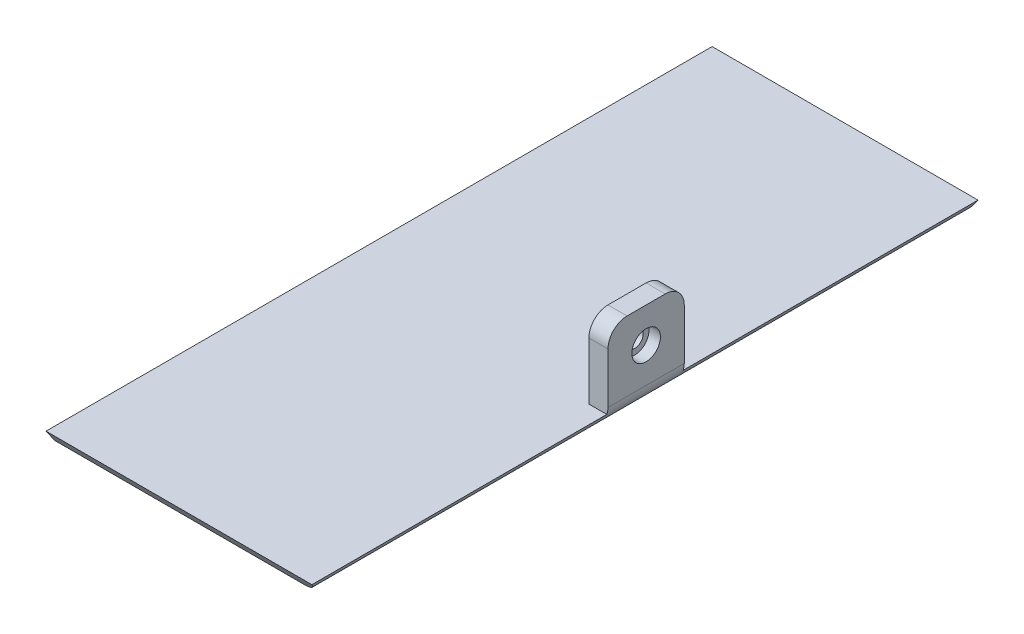
from build123d import *

# Parameters (mm, degrees)
BOSS_EXTRUDE1_DEPTH     = 70
SKETCH3_W               = 5
SKETCH3_H               = 20
BOSS_EXTRUDE2_DEPTH     = 20
CUT_EXTRUDE2_DEPTH      = 114.967153248
CUT_EXTRUDE2_DEPTH_BACK = 114.967153248
CUT_EXTRUDE3_REACH      = 115.967
SKETCH5_R               = 2.25
SKETCH7_R               = 3.75
CUT_EXTRUDE4_DEPTH      = 3
FILLET1_R               = 5


with BuildPart() as part:
    # Sketch1 → Boss-Extrude1 (new body)
    with BuildSketch(Plane.YZ):
        Polygon((-1.638304089, 85), (1.638304089, 87.294305745), (1.638304089, -87.294305745), (-1.638304089, -85), align=None)
    extrude(amount=BOSS_EXTRUDE1_DEPTH)

    # Sketch3 → Boss-Extrude2 (add)
    with BuildSketch(Plane(origin=(0, 1.638304089, 0), x_dir=(-1, 0, 0), z_dir=(0, 1, 0))):
        with Locations((-67.5, 0)):
            Rectangle(SKETCH3_W, SKETCH3_H)
    extrude(amount=BOSS_EXTRUDE2_DEPTH)

    # Sketch4 → Cut-Extrude2 (cut, two sides: drawn at the far end of the back side and taken through both)
    with BuildSketch(Plane(origin=(0, 0, 0), x_dir=(0, 1, 0), z_dir=(0, 0, 1)).offset(-CUT_EXTRUDE2_DEPTH_BACK)):
        with BuildLine():
            ThreePointArc((-1.638304089, -65), (-0.173837995, -68.535533906), (3.361695911, -70))
            Line((3.361695911, -70), (-1.638304089, -70))
            Line((-1.638304089, -70), (-1.638304089, -65))
        make_face()
    extrude(amount=CUT_EXTRUDE2_DEPTH + CUT_EXTRUDE2_DEPTH_BACK, mode=Mode.SUBTRACT)

    # Sketch5 → Cut-Extrude3 (cut, up to next)
    with BuildSketch(Plane.YZ.offset(70), mode=Mode.PRIVATE) as cut_extrude3_sk1:
        with Locations(Location((12.5, 0, 0), (0, 0, 270))):
            Circle(SKETCH5_R)
    cut_extrude3_tool1 = extrude(cut_extrude3_sk1.sketch, amount=-CUT_EXTRUDE3_REACH, mode=Mode.PRIVATE) & part.part
    add(cut_extrude3_tool1.solids().sort_by_distance((70, 12.5, 0))[0], mode=Mode.SUBTRACT)

    # Sketch7 → Cut-Extrude4 (cut)
    with BuildSketch(Plane.YZ.offset(70)):
        with Locations(Location((12.5, 0, 0), (0, 0, 270))):
            Circle(SKETCH7_R)
    extrude(amount=-CUT_EXTRUDE4_DEPTH, mode=Mode.SUBTRACT)

    # Fillet1
    fillet1_edges = [part.edges().sort_by_distance(p)[0] for p in [
        (67.5, 21.638304089, 10),
        (67.5, 21.638304089, -10),
    ]]
    fillet(fillet1_edges, radius=FILLET1_R)


solid = part.part
